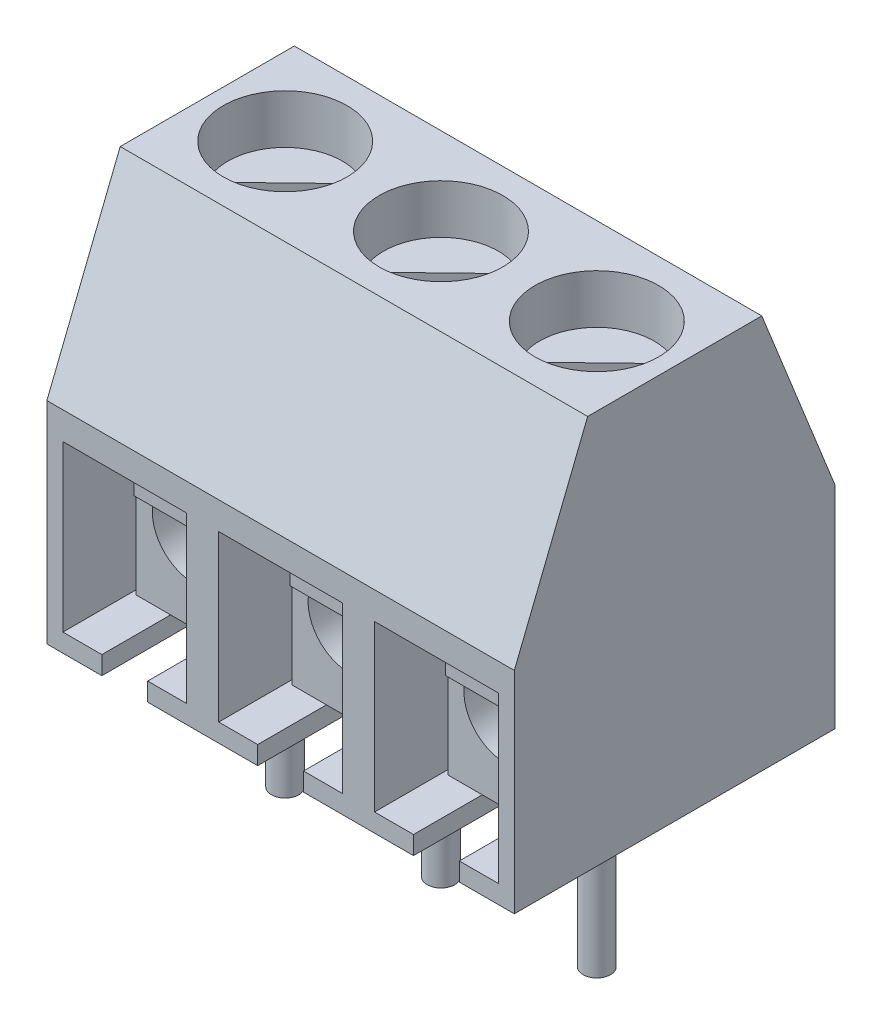
from build123d import *

# Parameters (mm, degrees)
BOSS_EXTRU_1_DEPTH         = 3.4
ENL_V_MAT_EXTRU_1_DEPTH    = 6
ENL_V_MAT_EXTRU_2_REACH    = 13.598
ESQUISSE3_R                = 1.35
BOSS_EXTRU_2_START         = -1
ESQUISSE4_R                = 1.25
BOSS_EXTRU_2_DEPTH         = 3.4
ENL_V_MAT_EXTRU_3_DEPTH    = 0.4
BOSS_EXTRU_3_START         = -1.5
ESQUISSE6_R                = 0.9
BOSS_EXTRU_3_DEPTH         = 4.5
ESQUISSE7_R                = 0.3
BOSS_EXTRU_4_DEPTH         = 4
EXTRU_MINCE1_DEPTH         = 0.7
R_P_TITION_LIN_AIRE2_COUNT = 3
R_P_TITION_LIN_AIRE2_PITCH = 3.4
R_P_TITION_LIN_AIRE3_COUNT = 3
R_P_TITION_LIN_AIRE3_PITCH = 3.4


with BuildPart() as part:
    # Esquisse1 → Boss.-Extru.1 (new body)
    with BuildSketch(Plane(origin=(0, 0, 0), x_dir=(0, 0, -1), z_dir=(1, 0, 0))):
        Polygon((0, 0), (0, 4.6), (1.6, 8.6), (5.4, 8.6), (7, 4.6), (7, 0), align=None)
    boss_extru_1 = extrude(amount=BOSS_EXTRU_1_DEPTH)

    # Esquisse2 → Enlèv. mat.-Extru.1 (cut)
    with BuildSketch(Plane.XY):
        Polygon((0.35, 0.4), (1.2, 0.4), (1.2, 0), (2.2, 0), (2.2, 0.4), (3.05, 0.4), (3.05, 4), (0.35, 4), align=None)
    enl_v_mat_extru_1 = extrude(amount=-ENL_V_MAT_EXTRU_1_DEPTH, mode=Mode.SUBTRACT)

    # Esquisse3 → Enlèv. mat.-Extru.2 (cut, up to next)
    with BuildSketch(Plane(origin=(0, 8.6, 0), x_dir=(1, 0, 0), z_dir=(0, 1, 0)), mode=Mode.PRIVATE) as enl_v_mat_extru_2_sk1:
        with Locations(Location((1.7, 3.5, 0), (0, 0, 270))):
            Circle(ESQUISSE3_R)
    enl_v_mat_extru_2_tool1 = extrude(enl_v_mat_extru_2_sk1.sketch, amount=-ENL_V_MAT_EXTRU_2_REACH, mode=Mode.PRIVATE) & part.part
    enl_v_mat_extru_2 = enl_v_mat_extru_2_tool1.solids().sort_by_distance((1.7, 8.6, -3.5))[0]
    add(enl_v_mat_extru_2, mode=Mode.SUBTRACT)

    # Répétition linéaire2: Boss.-Extru.1, Enlèv. mat.-Extru.1, Enlèv. mat.-Extru.2 ×3
    with Locations(*[(i * R_P_TITION_LIN_AIRE2_PITCH, 0, 0) for i in range(1, R_P_TITION_LIN_AIRE2_COUNT)]):
        add(boss_extru_1)
        add(enl_v_mat_extru_1, mode=Mode.SUBTRACT)
        add(enl_v_mat_extru_2, mode=Mode.SUBTRACT)


with BuildPart() as body_2:
    # Esquisse4 → Boss.-Extru.2 (new body)
    with BuildSketch(Plane(origin=(0, 8.6, 0), x_dir=(1, 0, 0), z_dir=(0, 1, 0)).offset(BOSS_EXTRU_2_START)):
        with Locations(Location((1.7, 3.5, 0), (0, 0, 270))):
            Circle(ESQUISSE4_R)
    extrude(amount=-BOSS_EXTRU_2_DEPTH)

    # Esquisse5 → Enlèv. mat.-Extru.3 (cut)
    with BuildSketch(Plane(origin=(0, 7.6, 0), x_dir=(1, 0, 0), z_dir=(0, 1, 0))):
        with BuildLine():
            Line((0.61870802, 2.87285755), (2.364496958, 4.558746331))
            ThreePointArc((2.364496958, 4.558746331), (2.59917475, 4.368322963), (2.78129198, 4.12714245))
            Line((2.78129198, 4.12714245), (1.035503042, 2.441253669))
            ThreePointArc((1.035503042, 2.441253669), (0.80082525, 2.631677037), (0.61870802, 2.87285755))
        make_face()
    extrude(amount=-ENL_V_MAT_EXTRU_3_DEPTH, mode=Mode.SUBTRACT)


with BuildPart() as body_3:
    # Esquisse6 → Boss.-Extru.3 (new body)
    with BuildSketch(Plane.XY.offset(BOSS_EXTRU_3_START)):
        Polygon((0.45, 0.4), (2.95, 0.4), (2.95, 3.9), (2.45, 3.9), (2.45, 3.65), (0.95, 3.65), (0.95, 3.9), (0.45, 3.9), align=None)
        with Locations((1.7, 2.15)):
            Circle(ESQUISSE6_R, mode=Mode.SUBTRACT)
    extrude(amount=-BOSS_EXTRU_3_DEPTH)

    # Esquisse7 → Boss.-Extru.4 (add)
    with BuildSketch(Plane.XZ.offset(-0.4)):
        with Locations((1.7, -3.5)):
            Circle(ESQUISSE7_R)
    extrude(amount=BOSS_EXTRU_4_DEPTH)


with BuildPart() as body_4:
    # Esquisse8 → Extru.-Mince1 (new, symmetric)
    with BuildSketch(Plane(origin=(1.7, 0, 0), x_dir=(0, 0, -1), z_dir=(1, 0, 0))):
        with BuildLine():
            Line((2.15, 3.9), (1.5, 3.9))
            ThreePointArc((1.5, 3.9), (1.075735931, 3.724264069), (0.9, 3.3))
            Line((0.9, 3.3), (0.9, 2.853369234))
            Line((0.9, 2.853369234), (2.391205681, 1.602099097))
            Line((2.391205681, 1.602099097), (2.519763203, 1.755307986))
            Line((2.519763203, 1.755307986), (1.1, 2.946630766))
            Line((1.1, 2.946630766), (1.1, 3.3))
            ThreePointArc((1.1, 3.3), (1.217157288, 3.582842712), (1.5, 3.7))
            Line((1.5, 3.7), (2.15, 3.7))
            Line((2.15, 3.7), (2.15, 3.9))
        make_face()
    extrude(amount=EXTRU_MINCE1_DEPTH, both=True)


with BuildPart() as r_p_tition_lin_aire3_1:
    # Répétition linéaire3: pattern copy
    add(body_3.part.moved(Location(Vector(1, 0, 0) * (1 * R_P_TITION_LIN_AIRE3_PITCH))))


with BuildPart() as r_p_tition_lin_aire3_2:
    # Répétition linéaire3: pattern copy
    add(body_3.part.moved(Location(Vector(1, 0, 0) * (2 * R_P_TITION_LIN_AIRE3_PITCH))))


with BuildPart() as r_p_tition_lin_aire3_3:
    # Répétition linéaire3: pattern copy
    add(body_4.part.moved(Location(Vector(1, 0, 0) * (1 * R_P_TITION_LIN_AIRE3_PITCH))))


with BuildPart() as r_p_tition_lin_aire3_4:
    # Répétition linéaire3: pattern copy
    add(body_4.part.moved(Location(Vector(1, 0, 0) * (2 * R_P_TITION_LIN_AIRE3_PITCH))))


with BuildPart() as r_p_tition_lin_aire3_5:
    # Répétition linéaire3: pattern copy
    add(body_2.part.moved(Location(Vector(1, 0, 0) * (1 * R_P_TITION_LIN_AIRE3_PITCH))))


with BuildPart() as r_p_tition_lin_aire3_6:
    # Répétition linéaire3: pattern copy
    add(body_2.part.moved(Location(Vector(1, 0, 0) * (2 * R_P_TITION_LIN_AIRE3_PITCH))))


solid = Compound([part.part, body_2.part, body_3.part, body_4.part, r_p_tition_lin_aire3_1.part, r_p_tition_lin_aire3_2.part, r_p_tition_lin_aire3_3.part, r_p_tition_lin_aire3_4.part, r_p_tition_lin_aire3_5.part, r_p_tition_lin_aire3_6.part])
